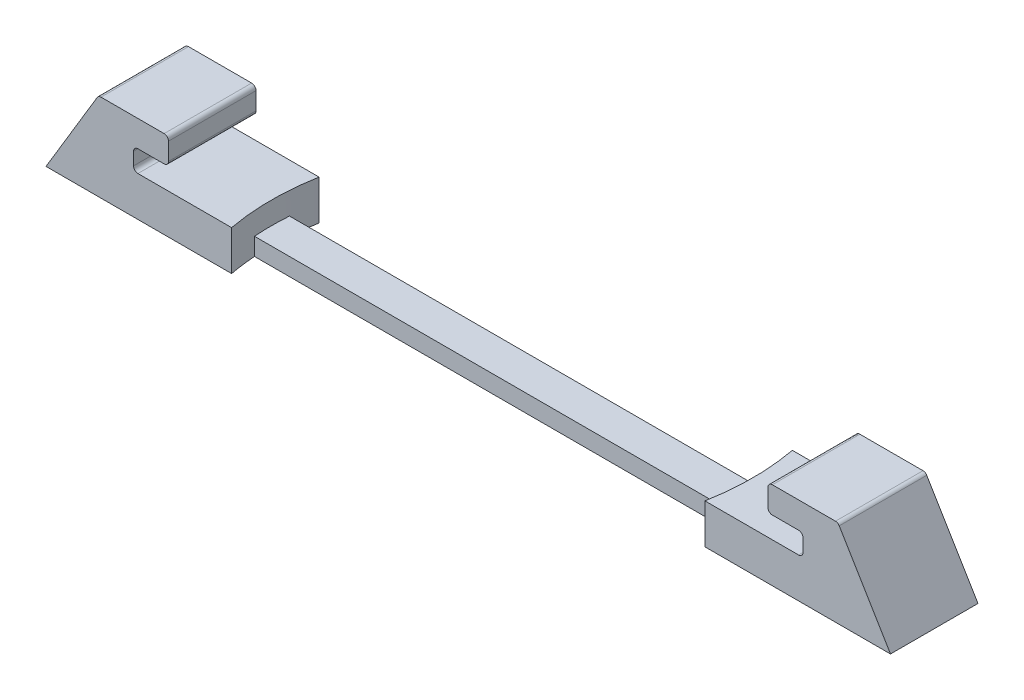
from build123d import *

# Parameters (mm, degrees)
BOSS_EXTRUDE1_DEPTH     = 180
SKETCH2_W               = 91.04
SKETCH2_H               = 5.45
CUT_EXTRUDE1_DEPTH      = 30
SKETCH3_W               = 91.04
SKETCH3_H               = 5.45
CUT_EXTRUDE2_DEPTH      = 30
FILLET1_R               = 1
FILLET2_R               = 1
FILLET3_R               = 1
CUT_EXTRUDE3_DEPTH      = 200.714859237
CUT_EXTRUDE3_DEPTH_BACK = 200.714859237
SKETCH4_R               = 4
SKETCH4_R_2             = 27.5
CUT_EXTRUDE4_DEPTH      = 200.890776426
CUT_EXTRUDE4_DEPTH_BACK = 200.890776426
SKETCH6_W               = 96.5
SKETCH6_H               = 85
SKETCH7_W               = 55
SKETCH7_H               = 4
BOSS_EXTRUDE3_DEPTH     = 2


with BuildPart() as part:
    # Sketch1 → Boss-Extrude1 (new body)
    with BuildSketch(Plane.XY):
        with BuildLine():
            Line((-76.35, 0.5), (-76.35, 1.95))
            ThreePointArc((-76.35, 1.95), (-76.203553391, 2.303553391), (-75.85, 2.45))
            Line((-75.85, 2.45), (-72.85, 2.45))
            ThreePointArc((-72.85, 2.45), (-72.496446609, 2.596446609), (-72.35, 2.95))
            Line((-72.35, 2.95), (-72.35, 4.95))
            ThreePointArc((-72.35, 4.95), (-72.496446609, 5.303553391), (-72.85, 5.45))
            Line((-72.85, 5.45), (-79.85, 5.45))
            Line((-79.85, 5.45), (-80.066904811, 5.45))
            ThreePointArc((-80.066904811, 5.45), (-80.313254218, 5.385099953), (-80.495651273, 5.207247878))
            Line((-80.495651273, 5.207247878), (-86.35, -4.55))
            Line((-86.35, -4.55), (-80.35, -4.55))
            Line((-80.35, -4.55), (-79.85, -4.55))
            Line((-79.85, -4.55), (-38.1, -4.55))
            Line((-38.1, -4.55), (-38.1, 0))
            Line((-38.1, 0), (-75.85, 0))
            ThreePointArc((-75.85, 0), (-76.203553391, 0.146446609), (-76.35, 0.5))
        make_face()
        with BuildLine():
            Line((-0.35, 0), (-38.1, 0))
            Line((-38.1, 0), (-38.1, -4.55))
            Line((-38.1, -4.55), (3.65, -4.55))
            Line((3.65, -4.55), (4.15, -4.55))
            Line((4.15, -4.55), (10.15, -4.55))
            Line((10.15, -4.55), (4.295651273, 5.207247878))
            ThreePointArc((4.295651273, 5.207247878), (4.113254218, 5.385099953), (3.866904811, 5.45))
            Line((3.866904811, 5.45), (3.65, 5.45))
            Line((3.65, 5.45), (-3.35, 5.45))
            ThreePointArc((-3.35, 5.45), (-3.703553391, 5.303553391), (-3.85, 4.95))
            Line((-3.85, 4.95), (-3.85, 2.95))
            ThreePointArc((-3.85, 2.95), (-3.703553391, 2.596446609), (-3.35, 2.45))
            Line((-3.35, 2.45), (-0.35, 2.45))
            ThreePointArc((-0.35, 2.45), (0.003553391, 2.303553391), (0.15, 1.95))
            Line((0.15, 1.95), (0.15, 0.5))
            ThreePointArc((0.15, 0.5), (0.003553391, 0.146446609), (-0.35, 0))
        make_face()
    extrude(amount=BOSS_EXTRUDE1_DEPTH)

    # Sketch2 → Cut-Extrude1 (cut)
    with BuildSketch(Plane.XY.offset(180)):
        with Locations((-38.1, 2.725)):
            Rectangle(SKETCH2_W, SKETCH2_H)
    extrude(amount=-CUT_EXTRUDE1_DEPTH, mode=Mode.SUBTRACT)

    # Sketch3 → Cut-Extrude2 (cut)
    with BuildSketch(Plane(origin=(0, 0, 0), x_dir=(-1, 0, 0), z_dir=(0, 0, -1))):
        with Locations((38.1, 2.725)):
            Rectangle(SKETCH3_W, SKETCH3_H)
    extrude(amount=-CUT_EXTRUDE2_DEPTH, mode=Mode.SUBTRACT)

    # Fillet1
    fillet1_edges = [part.edges().sort_by_distance(p)[0] for p in [
        (-79.735, 0, 150),
    ]]
    fillet(fillet1_edges, radius=FILLET1_R)

    # Fillet2
    fillet2_edges = [part.edges().sort_by_distance(p)[0] for p in [
        (3.535, 0, 150),
    ]]
    fillet(fillet2_edges, radius=FILLET2_R)

    # Fillet3
    fillet3_edges = [part.edges().sort_by_distance(p)[0] for p in [
        (-79.735, 0, 30),
        (3.535, 0, 30),
    ]]
    fillet(fillet3_edges, radius=FILLET3_R)

    # Sketch4 → Cut-Extrude3 (cut, two sides: drawn at the far end of the back side and taken through both)
    with BuildSketch(Plane(origin=(0, 0, 0), x_dir=(1, 0, 0), z_dir=(0, 1, 0)).offset(-CUT_EXTRUDE3_DEPTH_BACK)):
        with BuildLine():
            Line((-28.1, -38), (-28.1, -2))
            ThreePointArc((-28.1, -2), (-27.514213562, -0.585786438), (-26.1, 0))
            Line((-26.1, 0), (-50.1, 0))
            ThreePointArc((-50.1, 0), (-48.685786438, -0.585786438), (-48.1, -2))
            Line((-48.1, -2), (-48.1, -38))
            ThreePointArc((-48.1, -38), (-47.514213562, -39.414213562), (-46.1, -40))
            Line((-46.1, -40), (-30.1, -40))
            ThreePointArc((-30.1, -40), (-28.685786438, -39.414213562), (-28.1, -38))
        make_face()
        with Locations(Location((-75.35, -10, 0), (0, 0, 270))):
            Circle(SKETCH4_R)
        with Locations(Location((-61.35, -20, 0), (0, 0, 270))):
            Circle(SKETCH4_R)
        with Locations(Location((-14.85, -20, 0), (0, 0, 270))):
            Circle(SKETCH4_R)
        with Locations(Location((-0.85, -10, 0), (0, 0, 270))):
            Circle(SKETCH4_R)
        with Locations(Location((-38.1, -90, 0), (0, 0, 270))):
            Circle(SKETCH4_R_2)
        with BuildLine():
            ThreePointArc((-30.1, -140), (-28.685786438, -140.585786438), (-28.1, -142))
            Line((-28.1, -142), (-28.1, -178))
            ThreePointArc((-28.1, -178), (-27.514213562, -179.414213562), (-26.1, -180))
            Line((-26.1, -180), (-50.1, -180))
            ThreePointArc((-50.1, -180), (-48.685786438, -179.414213562), (-48.1, -178))
            Line((-48.1, -178), (-48.1, -142))
            ThreePointArc((-48.1, -142), (-47.514213562, -140.585786438), (-46.1, -140))
            Line((-46.1, -140), (-30.1, -140))
        make_face()
        with Locations(Location((-61.35, -160, 0), (0, 0, 270))):
            Circle(SKETCH4_R)
        with Locations(Location((-75.35, -170, 0), (0, 0, 270))):
            Circle(SKETCH4_R)
        with Locations(Location((-14.85, -160, 0), (0, 0, 270))):
            Circle(SKETCH4_R)
        with Locations(Location((-0.85, -170, 0), (0, 0, 270))):
            Circle(SKETCH4_R)
    extrude(amount=CUT_EXTRUDE3_DEPTH + CUT_EXTRUDE3_DEPTH_BACK, mode=Mode.SUBTRACT)

    # Sketch6 → Cut-Extrude4 (cut, two sides: drawn at the far end of the back side and taken through both)
    with BuildSketch(Plane(origin=(0, 5.45, 0), x_dir=(1, 0, 0), z_dir=(0, 1, 0)).offset(-CUT_EXTRUDE4_DEPTH_BACK)):
        with Locations((-38.1, -137.5)):
            Rectangle(SKETCH6_W, SKETCH6_H)
        with Locations((-38.1, -42.5)):
            Rectangle(SKETCH6_W, SKETCH6_H)
    extrude(amount=CUT_EXTRUDE4_DEPTH + CUT_EXTRUDE4_DEPTH_BACK, mode=Mode.SUBTRACT)


with BuildPart() as cut_extrude4_piece_1:
    # of the separate pieces the step leaves, piece 1, a body of its own (cut_extrude4_pieces)
    add(part.part.solids().sort_by_distance((-0.35, 0, 85))[0])



with BuildPart() as cut_extrude4_piece_2:
    # of the separate pieces the step leaves, piece 2, a body of its own (cut_extrude4_pieces)
    add(part.part.solids().sort_by_distance((-65.141634566, 0, 85))[0])


with BuildPart() as cut_extrude4_piece_1_1:
    add(cut_extrude4_piece_1.part)

    add(cut_extrude4_piece_2.part)  # Boss-Extrude3 merges Cut-Extrude4 piece 2
    # Sketch7 → Boss-Extrude3 (add)
    with BuildSketch(Plane(origin=(0, -4.55, 0), x_dir=(1, 0, 0), z_dir=(0, 1, 0))):
        with Locations((-38.1, -89.999911505)):
            Rectangle(SKETCH7_W, SKETCH7_H)
    extrude(amount=BOSS_EXTRUDE3_DEPTH)


solid = cut_extrude4_piece_1_1.part
